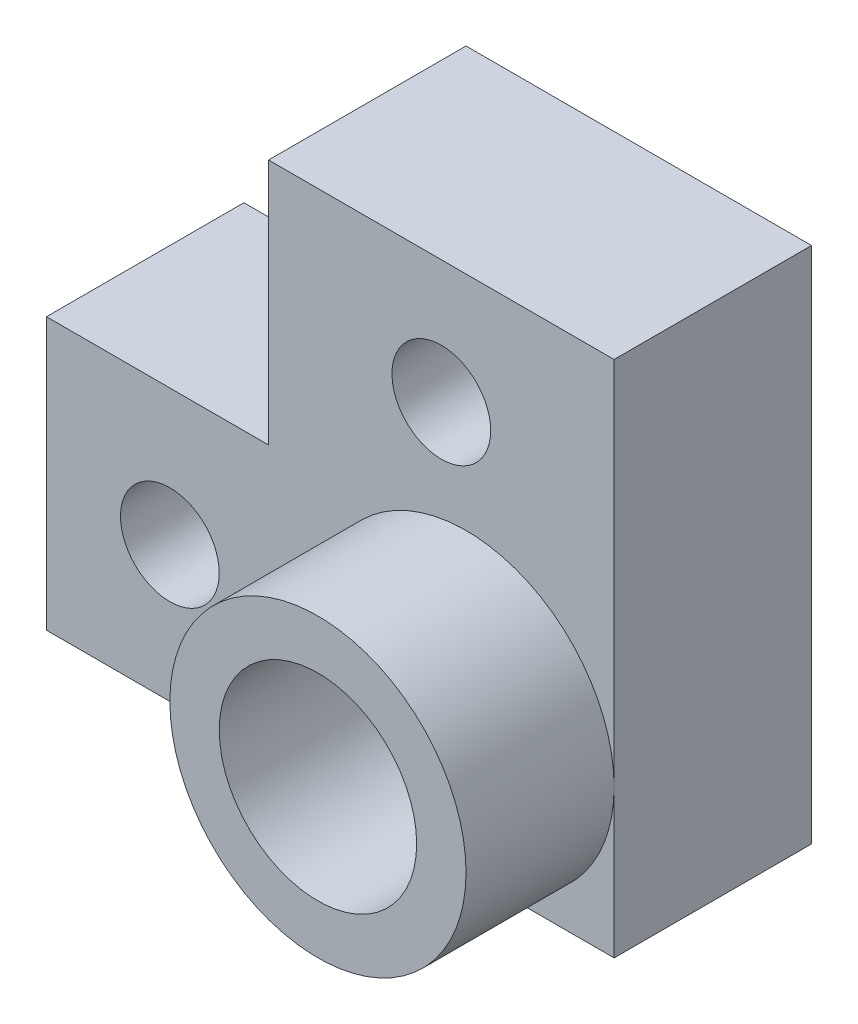
from build123d import *

# Parameters (mm, degrees)
SKETCH1_W           = 23
SKETCH1_H           = 11
BOSS_EXTRUDE1_DEPTH = 8
SKETCH2_W           = 14
SKETCH2_H           = 8
BOSS_EXTRUDE2_DEPTH = 10
SKETCH3_R           = 2
CUT_EXTRUDE1_DEPTH  = 20
SKETCH4_R           = 4
CUT_EXTRUDE2_DEPTH  = 20
BOSS_EXTRUDE3_START = 6
SKETCH5_R           = 6
SKETCH5_R_2         = 4
BOSS_EXTRUDE3_DEPTH = 6


with BuildPart() as part:
    # Sketch1 → Boss-Extrude1 (new body)
    with BuildSketch(Plane.XY):
        with Locations((-1.294701987, 6.413907285)):
            Rectangle(SKETCH1_W, SKETCH1_H)
    extrude(amount=BOSS_EXTRUDE1_DEPTH)

    # Sketch2 → Boss-Extrude2 (add)
    with BuildSketch(Plane(origin=(0, 11.913907285, 0), x_dir=(1, 0, 0), z_dir=(0, 1, 0))):
        with Locations((3.205298013, -4)):
            Rectangle(SKETCH2_W, SKETCH2_H)
    extrude(amount=BOSS_EXTRUDE2_DEPTH)

    # Sketch3 → Cut-Extrude1 (cut)
    with BuildSketch(Plane.XY.offset(8)):
        with Locations((-7.794701987, 6.413907285)):
            Circle(SKETCH3_R)
        with Locations((3.205298013, 16.913907285)):
            Circle(SKETCH3_R)
    extrude(amount=-CUT_EXTRUDE1_DEPTH, mode=Mode.SUBTRACT)

    # Sketch4 → Cut-Extrude2 (cut)
    with BuildSketch(Plane.XY.offset(8)):
        with Locations((4.205298013, 6.913907285)):
            Circle(SKETCH4_R)
    extrude(amount=-CUT_EXTRUDE2_DEPTH, mode=Mode.SUBTRACT)

    # Sketch5 → Boss-Extrude3 (add)
    with BuildSketch(Plane.XY.offset(8).offset(BOSS_EXTRUDE3_START)):
        with Locations((4.205298013, 6.913907285)):
            Circle(SKETCH5_R)
        with Locations((4.205298013, 6.913907285)):
            Circle(SKETCH5_R_2, mode=Mode.SUBTRACT)
    extrude(amount=-BOSS_EXTRUDE3_DEPTH)


solid = part.part
